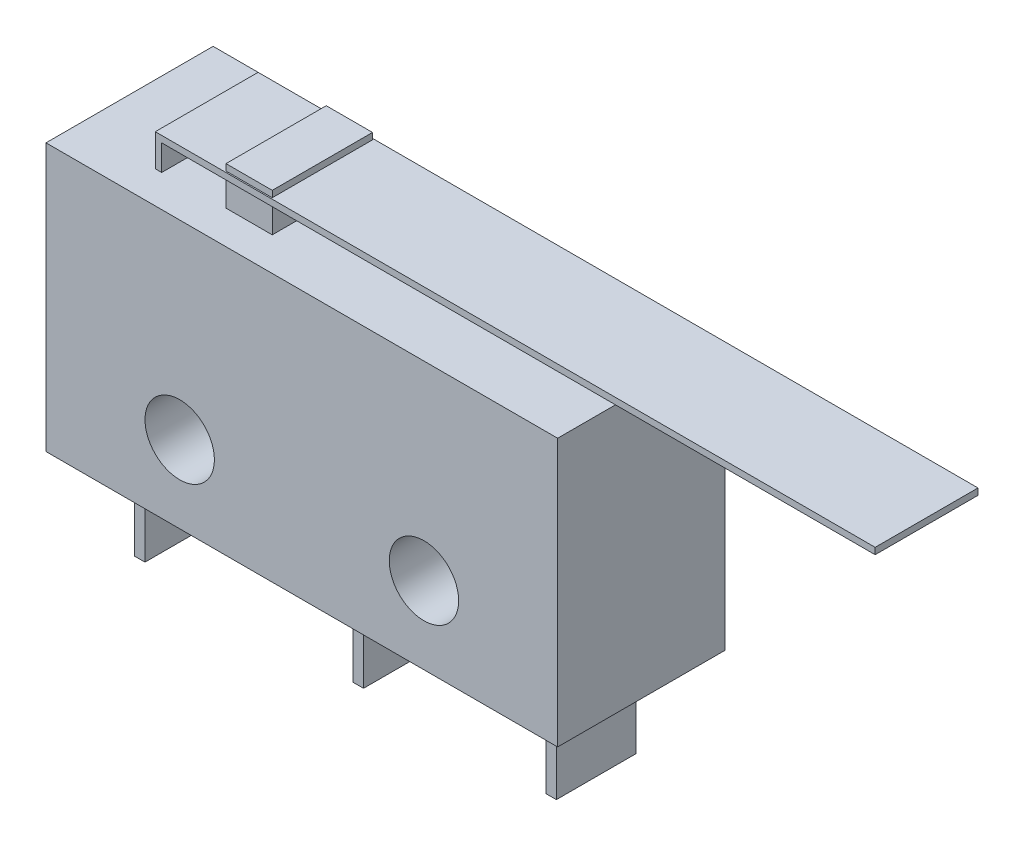
from build123d import *

# Parameters (mm, degrees)
ESQUISSE1_W        = 19.9
ESQUISSE1_H        = 10.4
BOSS_EXTRU_1_DEPTH = 3.25
D_GAGEMENT_M2_51_D = 2.7
ESQUISSE4_W        = 0.4
ESQUISSE4_H        = 3.1
BOSS_EXTRU_2_DEPTH = 3.5
ESQUISSE5_W        = 1.8
ESQUISSE5_H        = 3.9
BOSS_EXTRU_3_DEPTH = 1.5
BOSS_EXTRU_4_DEPTH = 2


with BuildPart() as part:
    # Esquisse1 → Boss.-Extru.1 (new, symmetric)
    with BuildSketch(Plane.XY):
        Rectangle(ESQUISSE1_W, ESQUISSE1_H)
    extrude(amount=BOSS_EXTRU_1_DEPTH, both=True)

    # Dégagement M2.51 (through all)
    with Locations(Plane.XY.offset(3.25)):
        with Locations((-4.75, -2.2), (4.75, -2.2)):
            Hole(D_GAGEMENT_M2_51_D / 2)

    # Esquisse4 → Boss.-Extru.2 (add)
    with BuildSketch(Plane.XZ.offset(5.2)):
        with Locations((0.5, 0)):
            Rectangle(ESQUISSE4_W, ESQUISSE4_H)
        with Locations((8, 0)):
            Rectangle(ESQUISSE4_W, ESQUISSE4_H)
        with Locations((-8, 0)):
            Rectangle(ESQUISSE4_W, ESQUISSE4_H)
    extrude(amount=BOSS_EXTRU_2_DEPTH)

    # Esquisse5 → Boss.-Extru.3 (add)
    with BuildSketch(Plane(origin=(0, 5.2, 0), x_dir=(1, 0, 0), z_dir=(0, 1, 0))):
        with Locations((-3.35, 0)):
            Rectangle(ESQUISSE5_W, ESQUISSE5_H)
    extrude(amount=BOSS_EXTRU_3_DEPTH)

    # Esquisse6 → Boss.-Extru.4 (add, symmetric)
    with BuildSketch(Plane.XY):
        Polygon((-6.7, 5.2), (-6.7, 6.2), (21.05, 6.2), (21.05, 6.45), (-6.95, 6.45), (-6.95, 5.2), align=None)
    extrude(amount=BOSS_EXTRU_4_DEPTH, both=True)


solid = part.part
